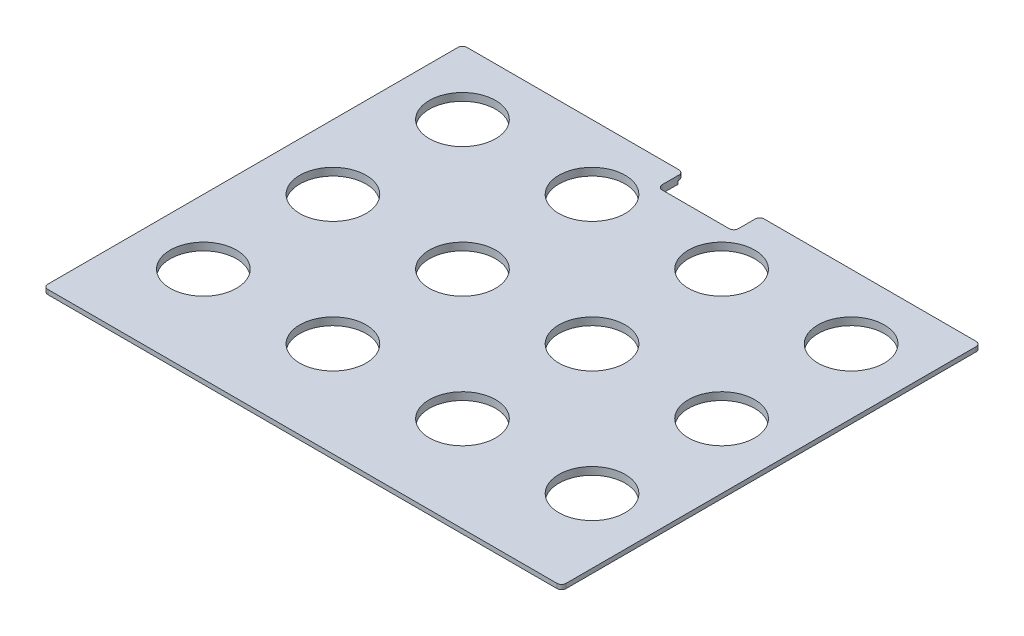
from build123d import *

# Parameters (mm, degrees)
SKETCH_1_W          = 340
SKETCH_1_H          = 255
EXTRUDE_1_DEPTH     = 3
EXTRUDE_2_DEPTH     = 2
SKETCH_3_R          = 21.75
SKETCH_3_W          = 50
SKETCH_3_H          = 17
CUT_EXTRUDE_1_DEPTH = 5
EXTRUDE_START       = -3
SKETCH_4_W          = 340
SKETCH_4_H          = 20
EXTRUDE_3_DEPTH     = 3
FILLET_1_R          = 3


with BuildPart() as part:
    # 草圖1 → 填料-伸長1 (new body)
    with BuildSketch(Plane(origin=(0, 0, 0), x_dir=(1, 0, 0), z_dir=(0, 1, 0))):
        Rectangle(SKETCH_1_W, SKETCH_1_H)
    extrude(amount=EXTRUDE_1_DEPTH)

    # 草圖2 → 填料-伸長2 (add)
    with BuildSketch(Plane.XZ):
        Polygon((-166.5, 100.5), (-143, 124), (143, 124), (166.5, 100.5), (166.5, -124), (-166.5, -124), align=None)
    extrude(amount=EXTRUDE_2_DEPTH)

    # 草圖3 → 除料-伸長1 (cut)
    with BuildSketch(Plane(origin=(0, 3, 0), x_dir=(1, 0, 0), z_dir=(0, 1, 0))):
        with Locations(Location((-127.5, 85, 0), (0, 0, 270))):
            Circle(SKETCH_3_R)
        with Locations(Location((-42.5, 85, 0), (0, 0, 270))):
            Circle(SKETCH_3_R)
        with Locations(Location((-127.5, 0, 0), (0, 0, 270))):
            Circle(SKETCH_3_R)
        with Locations(Location((-42.5, 0, 0), (0, 0, 270))):
            Circle(SKETCH_3_R)
        with Locations(Location((-127.5, -85, 0), (0, 0, 270))):
            Circle(SKETCH_3_R)
        with Locations(Location((-42.5, -85, 0), (0, 0, 270))):
            Circle(SKETCH_3_R)
        with Locations(Location((127.5, -85, 0), (0, 0, 90))):
            Circle(SKETCH_3_R)
        with Locations(Location((42.5, -85, 0), (0, 0, 90))):
            Circle(SKETCH_3_R)
        with Locations(Location((42.5, 0, 0), (0, 0, 90))):
            Circle(SKETCH_3_R)
        with Locations(Location((127.5, 0, 0), (0, 0, 90))):
            Circle(SKETCH_3_R)
        with Locations(Location((127.5, 85, 0), (0, 0, 90))):
            Circle(SKETCH_3_R)
        with Locations(Location((42.5, 85, 0), (0, 0, 90))):
            Circle(SKETCH_3_R)
        with Locations((0, 119)):
            Rectangle(SKETCH_3_W, SKETCH_3_H)
    extrude(amount=-CUT_EXTRUDE_1_DEPTH, mode=Mode.SUBTRACT)

    # 草圖4 → 填料-伸長3 (add)
    with BuildSketch(Plane(origin=(0, 3, 0), x_dir=(1, 0, 0), z_dir=(0, 1, 0)).offset(EXTRUDE_START)):
        with Locations((0, -137.5)):
            Rectangle(SKETCH_4_W, SKETCH_4_H)
    extrude(amount=EXTRUDE_3_DEPTH)

    # 圓角1
    fillet_1_edges = [part.edges().sort_by_distance(p)[0] for p in [
        (-170, 1.5, 147.5),
        (170, 1.5, 147.5),
        (-25, 1.5, -127.5),
        (-25, 0.5, -110.5),
        (25, 1.5, -127.5),
        (25, 0.5, -110.5),
        (-170, 1.5, -127.5),
        (170, 1.5, -127.5),
    ]]
    fillet(fillet_1_edges, radius=FILLET_1_R)


solid = part.part
